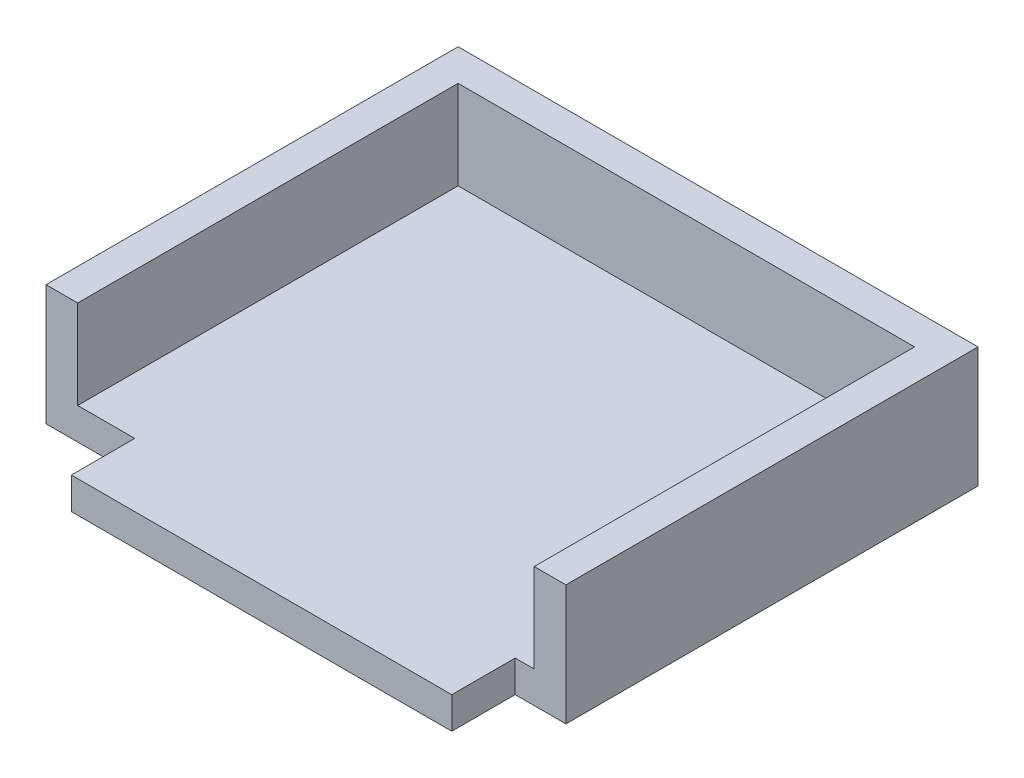
from build123d import *

# Parameters (mm, degrees)
EXTRUSION1_DEPTH = 5
EXTRUSION2_DEPTH = 14


with BuildPart() as part:
    # Esquisse1 → Extrusion1 (new body)
    with BuildSketch(Plane(origin=(0, 0, 0), x_dir=(1, 0, 0), z_dir=(0, 1, 0))):
        Polygon((-69.191486621, -43.16817348), (-55.191486621, -43.16817348), (-55.191486621, -53.16817348), (4.808513379, -53.16817348), (4.808513379, -43.16817348), (12.808513379, -43.16817348), (12.808513379, 21.83182652), (-69.191486621, 21.83182652), align=None)
    extrude(amount=EXTRUSION1_DEPTH)

    # Esquisse2 → Extrusion2 (add)
    with BuildSketch(Plane(origin=(0, 5, 0), x_dir=(1, 0, 0), z_dir=(0, 1, 0))):
        Polygon((12.808513379, -43.16817348), (12.808513379, 21.83182652), (-69.191486621, 21.83182652), (-69.191486621, -43.16817348), (-64.191486621, -43.16817348), (-64.191486621, 16.83182652), (7.808513379, 16.83182652), (7.808513379, -43.16817348), align=None)
    extrude(amount=EXTRUSION2_DEPTH)


solid = part.part
